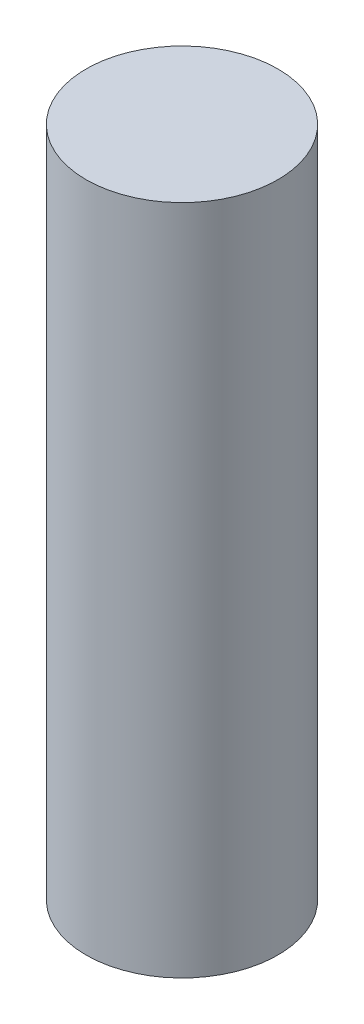
from build123d import *

# Parameters (mm, degrees)
SKETCH1_R           = 2
BOSS_EXTRUDE1_DEPTH = 7


with BuildPart() as part:
    # Sketch1 → Boss-Extrude1 (new, symmetric)
    with BuildSketch(Plane(origin=(0, 0, 0), x_dir=(1, 0, 0), z_dir=(0, 1, 0))):
        with Locations(Location((0, 0, 0), (0, 0, 270))):
            Circle(SKETCH1_R)
    extrude(amount=BOSS_EXTRUDE1_DEPTH, both=True)


solid = part.part
